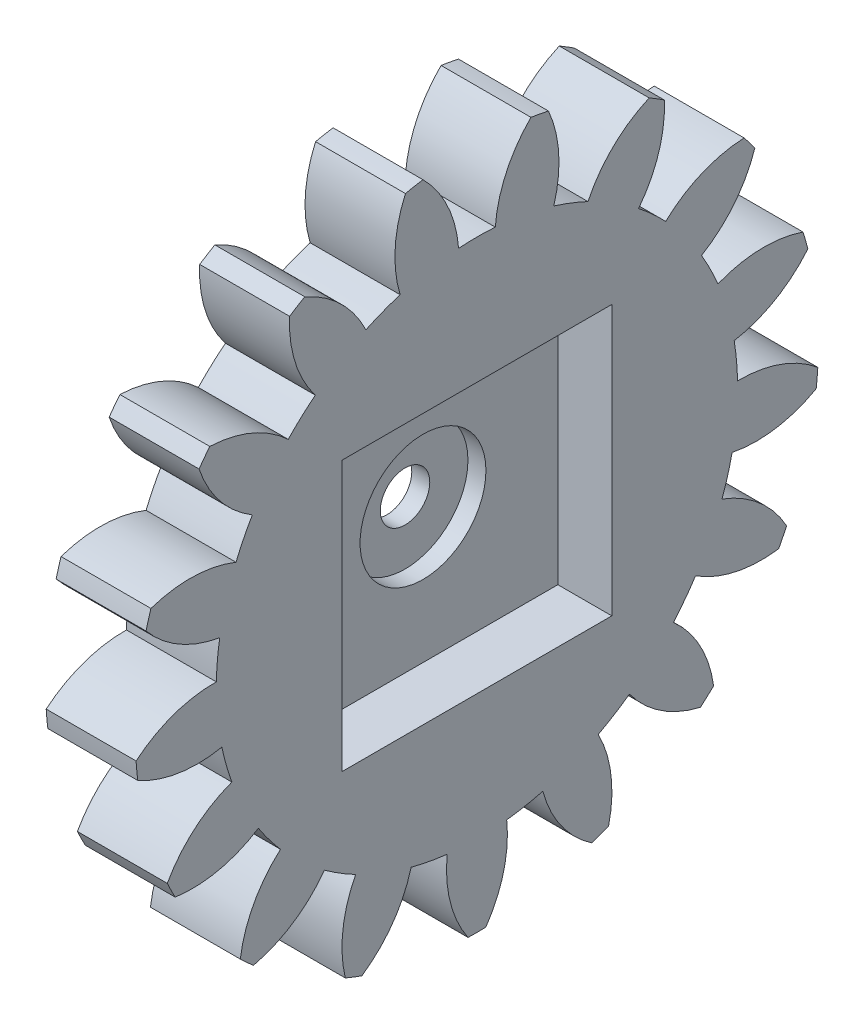
from build123d import *

# Parameters (mm, degrees)
BASPROSKE_W        = 5
BASPROSKE_H        = 19
TOOTHCUT_DEPTH     = 28.331300737
TEETHCUTS_COUNT    = 17
TEETHCUTS_ANGLE    = 338.823529412
BORSKE_R           = 1.375
BORE_DEPTH         = 50.0000508
SKETCH2_R          = 3.5
CUT_EXTRUDE2_DEPTH = 4
SKETCH1_W          = 15
SKETCH1_H          = 15
CUT_EXTRUDE1_DEPTH = 3


with BuildPart() as part:
    # BasProSke → Base-Revolve (revolve)
    with BuildSketch(Plane(origin=(0, 0, 0), x_dir=(1, 0, 0), z_dir=(0, 1, 0)), mode=Mode.PRIVATE) as base_revolve_sk:
        with Locations((2.5, 9.5)):
            Rectangle(BASPROSKE_W, BASPROSKE_H)
    revolve(base_revolve_sk.sketch.rotate(Axis((-10, 0, 0), (1, 0, 0)), 180), axis=Axis((-10, 0, 0), (1, 0, 0)))

    # TooCutSke → ToothCut (cut, through all)
    with BuildSketch(Plane(origin=(0, 0, 0), x_dir=(0, 0, -1), z_dir=(1, 0, 0))):
        with BuildLine():
            ThreePointArc((1.020352389, 14.463052306), (0, 14.499), (-1.020352389, 14.463052306))
            ThreePointArc((-1.020352389, 14.463052306), (-1.632621885, 16.804485203), (-3.026143023, 18.783192049))
            ThreePointArc((-3.026143023, 18.783192049), (0, 19.0254), (3.026143023, 18.783192049))
            ThreePointArc((3.026143023, 18.783192049), (1.632621885, 16.804485203), (1.020352389, 14.463052306))
        make_face()
    toothcut = extrude(amount=TOOTHCUT_DEPTH, mode=Mode.SUBTRACT)

    # TeethCuts: ToothCut ×17 about axis
    teethcuts_axis = Axis((-10, 0, 0), (1, 0, 0))
    for i in range(1, TEETHCUTS_COUNT):
        add(toothcut.rotate(teethcuts_axis, i * TEETHCUTS_ANGLE / (TEETHCUTS_COUNT - 1)), mode=Mode.SUBTRACT)

    # BorSke → Bore (cut, symmetric)
    with BuildSketch(Plane(origin=(0, 0, 0), x_dir=(0, 0, -1), z_dir=(1, 0, 0))):
        with Locations(Location((0, 0, 0), (0, 0, 180))):
            Circle(BORSKE_R)
    extrude(amount=BORE_DEPTH, both=True, mode=Mode.SUBTRACT)

    # Sketch2 → Cut-Extrude2 (cut)
    with BuildSketch(Plane(origin=(5, 0, 0), x_dir=(0, 0, -1), z_dir=(1, 0, 0))):
        Circle(SKETCH2_R)
    extrude(amount=-CUT_EXTRUDE2_DEPTH, mode=Mode.SUBTRACT)

    # Sketch1 → Cut-Extrude1 (cut)
    with BuildSketch(Plane(origin=(5, 0, 0), x_dir=(0, 0, -1), z_dir=(1, 0, 0))):
        Rectangle(SKETCH1_W, SKETCH1_H)
    extrude(amount=-CUT_EXTRUDE1_DEPTH, mode=Mode.SUBTRACT)


solid = part.part
